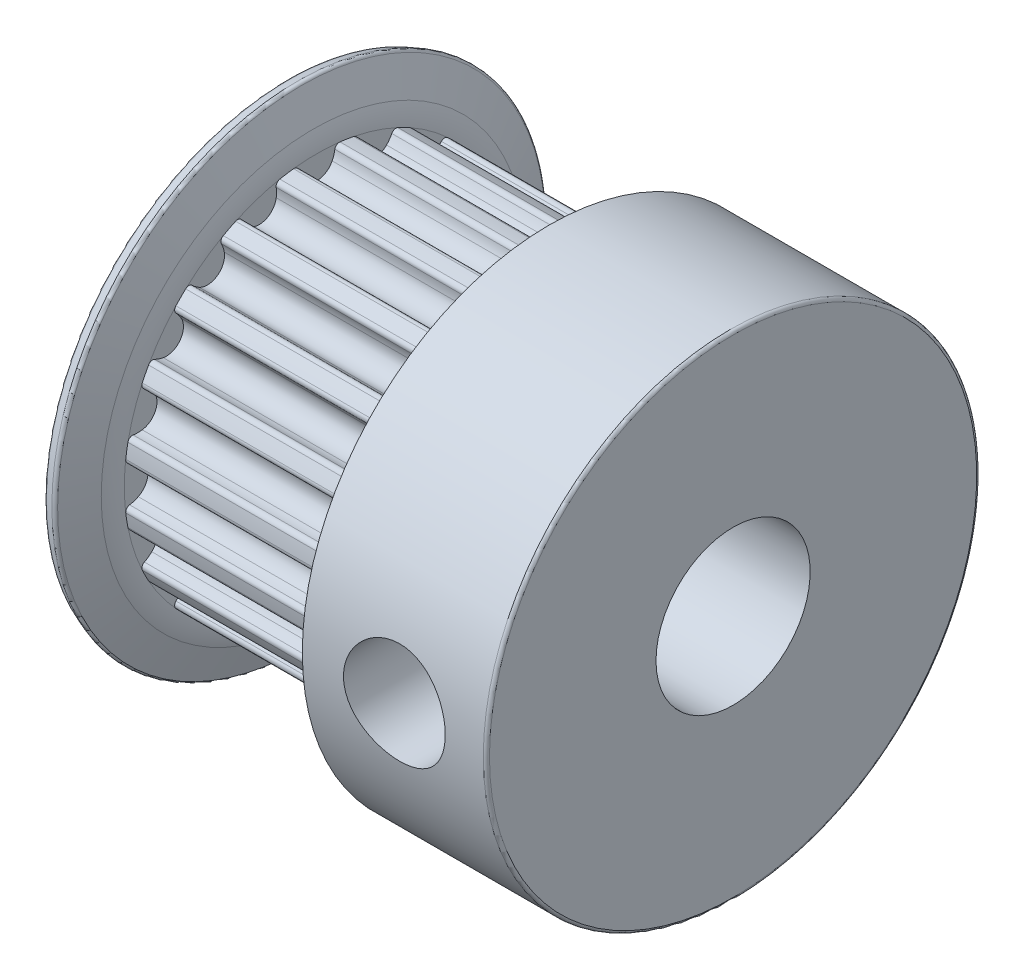
from build123d import *

# Parameters (mm, degrees)
SKETCH1_R           = 6.239197724
SKETCH1_R_2         = 2.5
BOSS_EXTRUDE1_DEPTH = 3.5
CUT_EXTRUDE1_DEPTH  = 3.5
CIRPATTERN1_COUNT   = 20
FILLET1_R           = 0.1
SKETCH6_W           = 1.65
SKETCH6_H           = 8


with BuildPart() as part:
    # Sketch1 → Boss-Extrude1 (new, symmetric)
    with BuildSketch(Plane(origin=(0, 0, 0), x_dir=(0, 0, -1), z_dir=(1, 0, 0))):
        Circle(SKETCH1_R)
        Circle(SKETCH1_R_2, mode=Mode.SUBTRACT)
    extrude(amount=BOSS_EXTRUDE1_DEPTH, both=True)

    # Sketch2 → Cut-Extrude1 (cut, symmetric)
    with BuildSketch(Plane(origin=(0, 0, 0), x_dir=(0, 0, -1), z_dir=(1, 0, 0))):
        with BuildLine():
            ThreePointArc((0.753665766, 6.19351081), (0, 6.239197724), (-0.753665766, 6.19351081))
            ThreePointArc((-0.753665766, 6.19351081), (-0.645307166, 6.164429342), (-0.587431713, 6.068316129))
            ThreePointArc((-0.587431713, 6.068316129), (-0.553499569, 5.924967979), (-0.498876404, 5.788160113))
            ThreePointArc((-0.498876404, 5.788160113), (0, 5.47636236), (0.498876404, 5.788160113))
            ThreePointArc((0.498876404, 5.788160113), (0.553499569, 5.924967979), (0.587431713, 6.068316129))
            ThreePointArc((0.587431713, 6.068316129), (0.645307166, 6.164429342), (0.753665766, 6.19351081))
        make_face()
    cut_extrude1 = extrude(amount=CUT_EXTRUDE1_DEPTH, both=True, mode=Mode.SUBTRACT)

    # CirPattern1: Cut-Extrude1 ×20 about axis
    cirpattern1_axis = Axis((0, 0, 0), (1, 0, 0))
    for i in range(1, CIRPATTERN1_COUNT):
        add(cut_extrude1.rotate(cirpattern1_axis, i * 360 / CIRPATTERN1_COUNT), mode=Mode.SUBTRACT)

    # Sketch3 → Revolve1 (revolve)
    with BuildSketch(Plane.XY, mode=Mode.PRIVATE) as revolve1_sk:
        with BuildLine():
            Line((-3.5, 2.5), (-3.5, 6.239197724))
            ThreePointArc((-3.5, 6.239197724), (-3.528735027, 6.562092031), (-3.614036981, 6.874837953))
            Line((-3.614036981, 6.874837953), (-4.03118248, 8))
            Line((-4.03118248, 8), (-4.5, 7.826189375))
            Line((-4.5, 7.826189375), (-4.082854501, 6.701027328))
            ThreePointArc((-4.082854501, 6.701027328), (-4.020877669, 6.473799222), (-4, 6.239197724))
            Line((-4, 6.239197724), (-4, 5))
            Line((-4, 5), (-4.25, 5))
            Line((-4.25, 5), (-4.25, 4.5))
            Line((-4.25, 4.5), (-4.5, 4.5))
            Line((-4.5, 4.5), (-4.5, 2.5))
            Line((-4.5, 2.5), (-3.5, 2.5))
        make_face()
        with BuildLine():
            Line((4.5, 4.5), (4.5, 2.5))
            Line((4.5, 2.5), (3.5, 2.5))
            Line((3.5, 2.5), (3.5, 6.239197724))
            ThreePointArc((3.5, 6.239197724), (3.528735027, 6.562092031), (3.614036981, 6.874837953))
            Line((3.614036981, 6.874837953), (4.03118248, 8))
            Line((4.03118248, 8), (4.5, 7.826189375))
            Line((4.5, 7.826189375), (4.082854501, 6.701027328))
            ThreePointArc((4.082854501, 6.701027328), (4.020877669, 6.473799222), (4, 6.239197724))
            Line((4, 6.239197724), (4, 5))
            Line((4, 5), (4.25, 5))
            Line((4.25, 5), (4.25, 4.5))
            Line((4.25, 4.5), (4.5, 4.5))
        make_face()
    revolve(revolve1_sk.sketch.rotate(Axis((0, 0, 0), (1, 0, 0)), 90), axis=Axis((0, 0, 0), (1, 0, 0)))

    # Sketch4 → Revolve2 (revolve)
    with BuildSketch(Plane.XY, mode=Mode.PRIVATE) as revolve2_sk:
        Polygon((4.03118248, 8), (10, 8), (10, 2.5), (3.742939694, 2.5), align=None)
    revolve(revolve2_sk.sketch.rotate(Axis((0, 0, 0), (1, 0, 0)), 90), axis=Axis((0, 0, 0), (1, 0, 0)))

    # Fillet1
    fillet1_edges = [part.edges().sort_by_distance(p)[0] for p in [
        (-4.03118248, 0, -8),
        (-4.5, 0, -7.826189375),
        (-4, 0, -5),
        (-4.25, 0, -5),
        (-4.25, 0, -4.5),
        (10, 0, -8),
    ]]
    fillet(fillet1_edges, radius=FILLET1_R)

    # Sketch6 → M4 Tapped Hole1 (revolve, cut)
    with BuildSketch(Plane.YZ.offset(7.01559124)):
        with Locations((0.825, 4)):
            Rectangle(SKETCH6_W, SKETCH6_H)
    revolve(axis=Axis((7.01559124, 0, -6.35), (0, 0, 1)), mode=Mode.SUBTRACT)


solid = part.part
